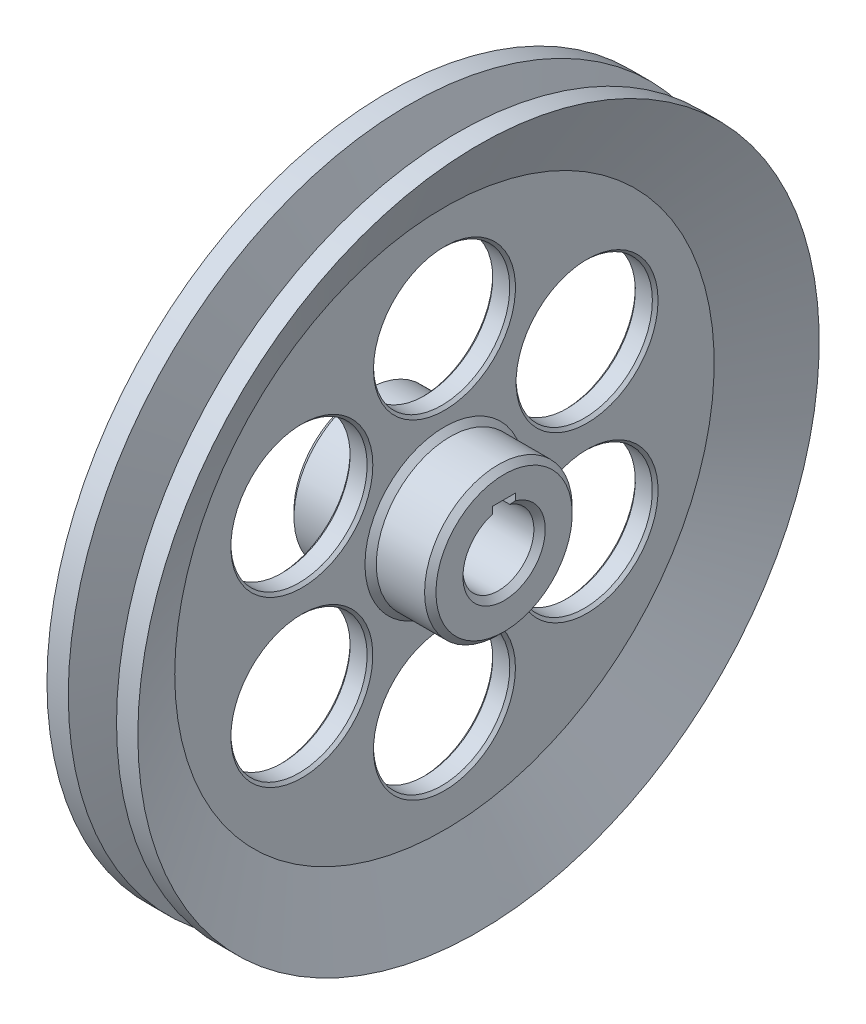
from build123d import *

# Parameters (mm, degrees)
WYTNIJ_WYCI_GNI_CIE1_REACH       = 178.918
SFAZOWANIE2_SIZE                 = 2
SFAZOWANIE3_SIZE                 = 2
WYTNIJ_WYCI_GNI_CIE2_REACH       = 174.166
SZKIC3_R                         = 24
SFAZOWANIE4_SIZE                 = 1
SZYK_KO_OWY2_COUNT               = 6
SFAZOWANIE4_OF_SZYK_KO_OWY2_SIZE = 1


with BuildPart() as part:
    # Szkic1 → Obrót2 (revolve)
    with BuildSketch(Plane.XY):
        Polygon((-4, 95), (-16, 120), (-8.5, 120), (-2.676476252, 104), (2.676476252, 104), (8.5, 120), (16, 120), (4, 95), (4, 26), (25, 26), (25, 0), (-25, 0), (-25, 26), (-4, 26), align=None)
    revolve(axis=Axis((-76.201663435, 0, 0), (1, 0, 0)))

    # Szkic2 → Wytnij-wyciągnięcie1 (cut, up to next)
    with BuildSketch(Plane.ZY.offset(25), mode=Mode.PRIVATE) as wytnij_wyci_gni_cie1_sk1:
        with BuildLine():
            Line((4, 11.842719282), (4, 16.3))
            Line((4, 16.3), (-4, 16.3))
            Line((-4, 16.3), (-4, 11.842719282))
            ThreePointArc((-4, 11.842719282), (0, -12.5), (4, 11.842719282))
        make_face()
    wytnij_wyci_gni_cie1_tool1 = extrude(wytnij_wyci_gni_cie1_sk1.sketch, amount=-WYTNIJ_WYCI_GNI_CIE1_REACH, mode=Mode.PRIVATE) & part.part
    add(wytnij_wyci_gni_cie1_tool1.solids().sort_by_distance((-25, 0.877795, 0))[0], mode=Mode.SUBTRACT)

    # Sfazowanie2
    sfazowanie2_edges = [part.edges().sort_by_distance(p)[0] for p in [
        (-25, -12.5, 0),
        (25, -12.5, 0),
    ]]
    chamfer(sfazowanie2_edges, length=SFAZOWANIE2_SIZE)

    # Sfazowanie3
    sfazowanie3_edges = [part.edges().sort_by_distance(p)[0] for p in [
        (-25, -26, 0),
        (-4, -26, 0),
        (25, -26, 0),
        (4, -26, 0),
    ]]
    chamfer(sfazowanie3_edges, length=SFAZOWANIE3_SIZE)

    # Szkic3 → Wytnij-wyciągnięcie2 (cut, up to next)
    with BuildSketch(Plane.ZY.offset(4), mode=Mode.PRIVATE) as wytnij_wyci_gni_cie2_sk1:
        with Locations((0, 58)):
            Circle(SZKIC3_R)
    wytnij_wyci_gni_cie2_tool1 = extrude(wytnij_wyci_gni_cie2_sk1.sketch, amount=-WYTNIJ_WYCI_GNI_CIE2_REACH, mode=Mode.PRIVATE) & part.part
    wytnij_wyci_gni_cie2 = wytnij_wyci_gni_cie2_tool1.solids().sort_by_distance((-4, 58, 0))[0]
    add(wytnij_wyci_gni_cie2, mode=Mode.SUBTRACT)

    # Sfazowanie4
    sfazowanie4_edges = [part.edges().sort_by_distance(p)[0] for p in [
        (-4, 58, -24),
        (4, 58, -24),
    ]]
    chamfer(sfazowanie4_edges, length=SFAZOWANIE4_SIZE)

    # Szyk kołowy2: Wytnij-wyciągnięcie2 ×6 about axis
    szyk_ko_owy2_axis = Axis((0, 0, 0), (-1, 0, 0))
    for i in range(1, SZYK_KO_OWY2_COUNT):
        add(wytnij_wyci_gni_cie2.rotate(szyk_ko_owy2_axis, i * 360 / SZYK_KO_OWY2_COUNT), mode=Mode.SUBTRACT)

    # Sfazowanie4 of Szyk kołowy2
    sfazowanie4_of_szyk_ko_owy2_edges = [part.edges().sort_by_distance(p)[0] for p in [
        (-4, 8.215390309, -62.229473419),
        (4, 8.215390309, -62.229473419),
        (-4, -49.784609691, -38.229473419),
        (4, -49.784609691, -38.229473419),
        (-4, -58, 24),
        (4, -58, 24),
        (-4, -8.215390309, 62.229473419),
        (4, -8.215390309, 62.229473419),
        (-4, 49.784609691, 38.229473419),
        (4, 49.784609691, 38.229473419),
    ]]
    chamfer(sfazowanie4_of_szyk_ko_owy2_edges, length=SFAZOWANIE4_OF_SZYK_KO_OWY2_SIZE)


solid = part.part
